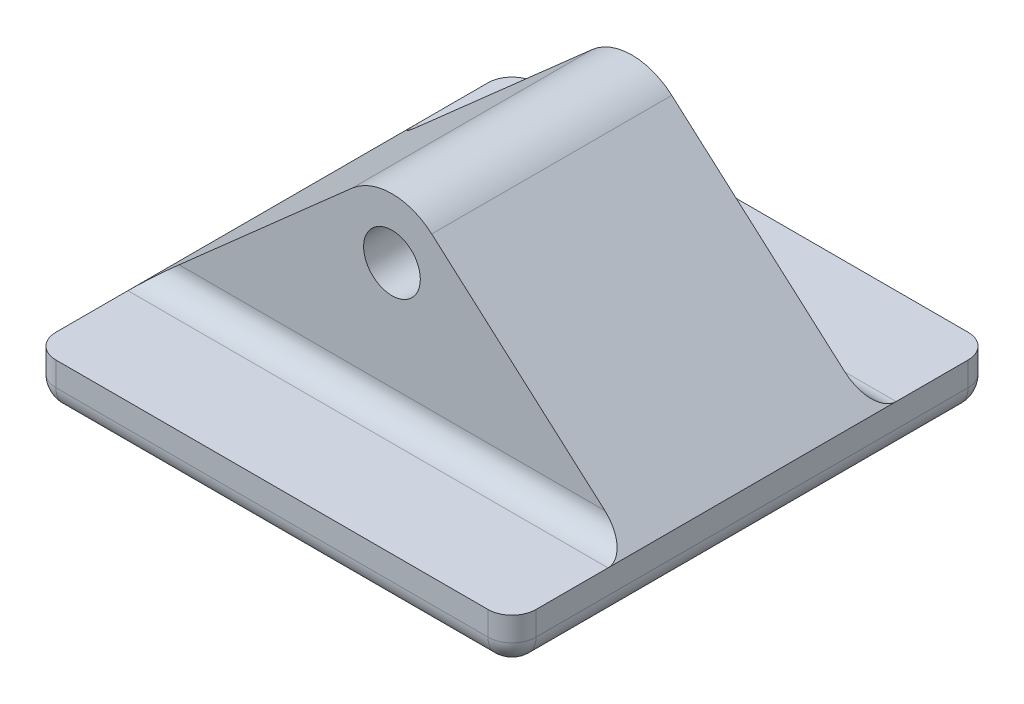
from build123d import *

# Parameters (mm, degrees)
SKETCH1_W           = 25.4
SKETCH1_H           = 25.4
BOSS_EXTRUDE1_DEPTH = 2.54
SKETCH2_W           = 25.4
SKETCH2_H           = 12.7
BOSS_EXTRUDE2_DEPTH = 12.7
SKETCH3_R           = 1.5
CUT_EXTRUDE1_DEPTH  = 28.503637941
FILLET1_R           = 1.27


with BuildPart() as part:
    # Sketch1 → Boss-Extrude1 (new body)
    with BuildSketch(Plane(origin=(0, 0, 0), x_dir=(1, 0, 0), z_dir=(0, 1, 0))):
        Rectangle(SKETCH1_W, SKETCH1_H)
    extrude(amount=BOSS_EXTRUDE1_DEPTH)

    # Sketch2 → Boss-Extrude2 (add)
    with BuildSketch(Plane(origin=(0, 2.54, 0), x_dir=(1, 0, 0), z_dir=(0, 1, 0))):
        Rectangle(SKETCH2_W, SKETCH2_H)
    extrude(amount=BOSS_EXTRUDE2_DEPTH)

    # Sketch3 → Cut-Extrude1 (cut, through all)
    with BuildSketch(Plane.XY.offset(6.35)):
        with BuildLine():
            Line((-12.7, 2.54), (-2.102335281, 11.904245966))
            ThreePointArc((-2.102335281, 11.904245966), (0, 12.7), (2.102335281, 11.904245966))
            Line((2.102335281, 11.904245966), (12.7, 2.54))
            Line((12.7, 2.54), (12.7, 15.24))
            Line((12.7, 15.24), (-12.7, 15.24))
            Line((-12.7, 15.24), (-12.7, 2.54))
        make_face()
        with Locations((0, 9.525)):
            Circle(SKETCH3_R)
    extrude(amount=-CUT_EXTRUDE1_DEPTH, mode=Mode.SUBTRACT)

    # Fillet1
    fillet1_edges = [part.edges().sort_by_distance(p)[0] for p in [
        (0, 0, -12.7),
        (-12.7, 0, 0),
        (0, 0, 12.7),
        (12.7, 0, 0),
        (-12.7, 1.27, 12.7),
        (12.7, 1.27, 12.7),
        (-12.7, 1.27, -12.7),
        (12.7, 1.27, -12.7),
        (0, 2.54, -6.35),
        (0, 2.54, 6.35),
    ]]
    fillet(fillet1_edges, radius=FILLET1_R)


solid = part.part
